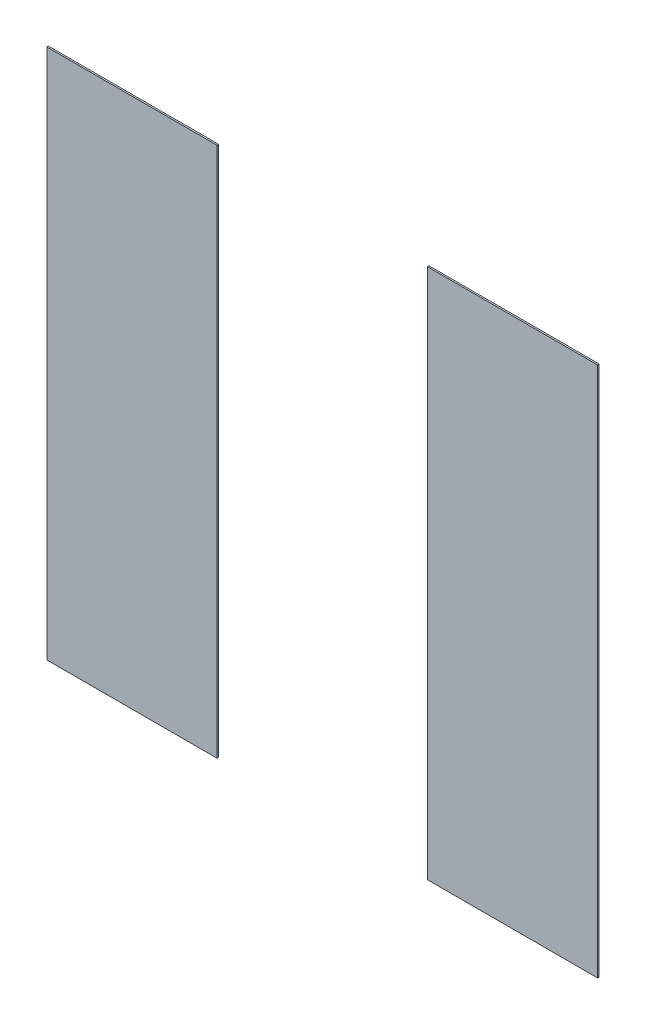
from build123d import *

# Parameters (mm, degrees)
SKETCH_1_W        = 2.159
SKETCH_1_H        = 6.731
EXTRUDE_1_DEPTH   = 0.02
EXTRUDE_1_2_DEPTH = 0.02


with BuildPart() as part:
    # 草图1 → 凸台-拉伸1 (new body)
    with BuildSketch(Plane.XY):
        with Locations((-2.413, 0)):
            Rectangle(SKETCH_1_W, SKETCH_1_H)
    extrude(amount=EXTRUDE_1_DEPTH)


with BuildPart() as body_2:
    # 草图1 → Extrude 1 2 (new body)
    with BuildSketch(Plane.XY):
        with Locations((2.413, 0)):
            Rectangle(SKETCH_1_W, SKETCH_1_H)
    extrude(amount=EXTRUDE_1_2_DEPTH)


solid = Compound([part.part, body_2.part])
